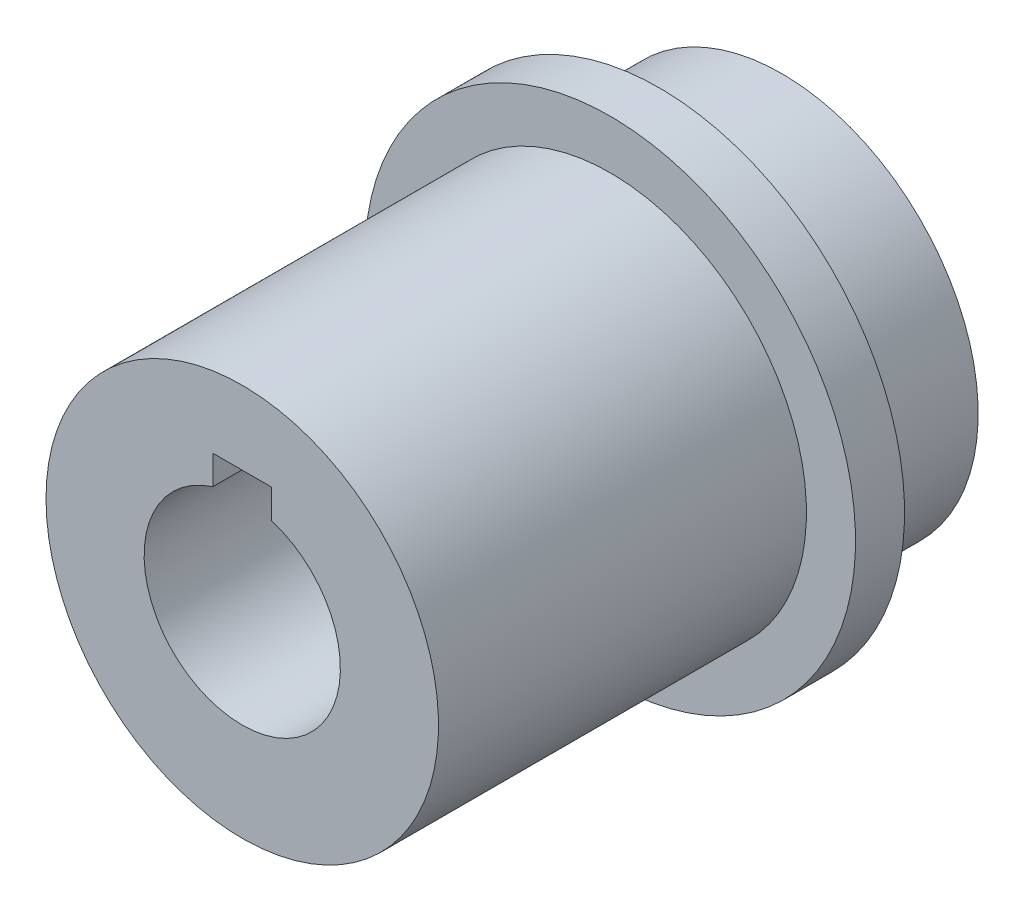
from build123d import *

# Parameters (mm, degrees)
SKETCH1_R           = 40
SKETCH1_R_2         = 20
BOSS_EXTRUDE1_DEPTH = 110
SKETCH2_R           = 50
SKETCH2_R_2         = 20
BOSS_EXTRUDE2_DEPTH = 10
SKETCH3_W           = 12
SKETCH3_H           = 14.623455079
CUT_EXTRUDE1_DEPTH  = 131.766968306


with BuildPart() as part:
    # Sketch1 → Boss-Extrude1 (new body)
    with BuildSketch(Plane.XY):
        Circle(SKETCH1_R)
        Circle(SKETCH1_R_2, mode=Mode.SUBTRACT)
    extrude(amount=BOSS_EXTRUDE1_DEPTH)

    # Sketch2 → Boss-Extrude2 (add)
    with BuildSketch(Plane.XY.offset(25)):
        Circle(SKETCH2_R)
        Circle(SKETCH2_R_2, mode=Mode.SUBTRACT)
    extrude(amount=BOSS_EXTRUDE2_DEPTH)

    # Sketch3 → Cut-Extrude1 (cut, through all)
    with BuildSketch(Plane(origin=(0, 0, 0), x_dir=(-1, 0, 0), z_dir=(0, 0, -1))):
        with Locations((0, 17.688272461)):
            Rectangle(SKETCH3_W, SKETCH3_H)
    extrude(amount=-CUT_EXTRUDE1_DEPTH, mode=Mode.SUBTRACT)


solid = part.part
